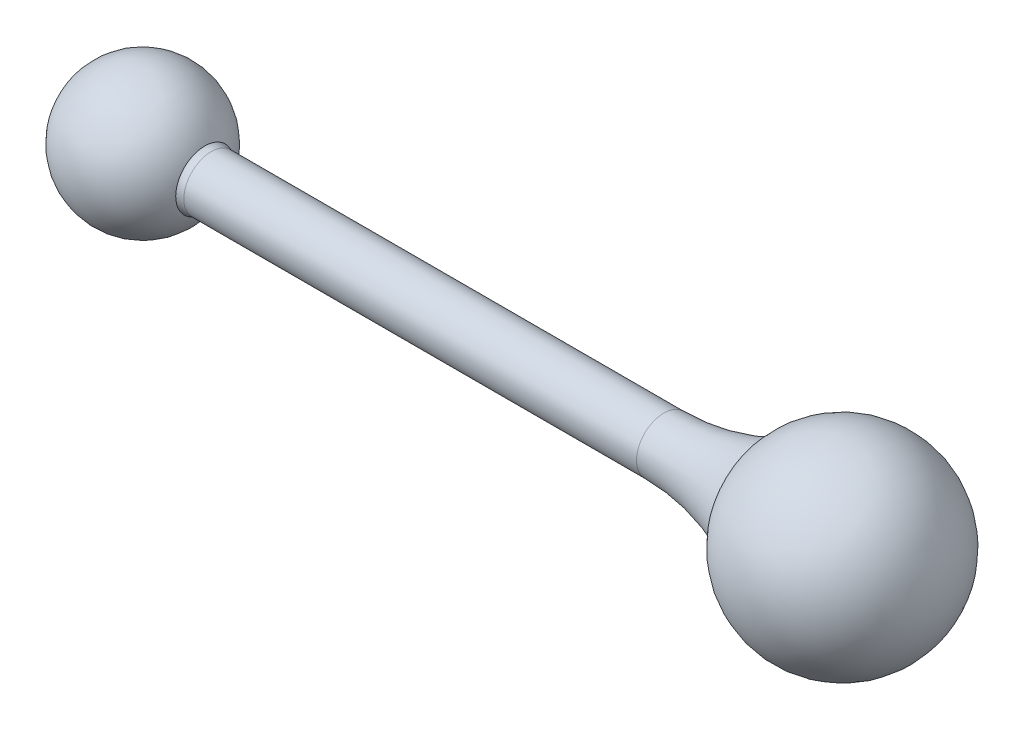
from build123d import *


with BuildPart() as part:
    # Sketch1 → Revolve1 (revolve)
    with BuildSketch(Plane.XY):
        with BuildLine():
            Line((0, 0), (-14, 0))
            ThreePointArc((-14, 0), (-7, -7), (0, 0))
        make_face()
    revolve(axis=Axis((0, 0, 0), (-1, 0, 0)))

    # Sketch2 → Revolve2 (revolve)
    with BuildSketch(Plane.XY, mode=Mode.PRIVATE) as revolve2_sk:
        with BuildLine():
            ThreePointArc((-14, 0), (-13.765454167, -1.796838865), (-13.077534312, -3.473265997))
            ThreePointArc((-13.077534312, -3.473265997), (-16.46124867, -2.372395271), (-20, -2))
            Line((-20, -2), (-53, -2))
            ThreePointArc((-53, -2), (-53.242535625, -2.0298575), (-53.470588235, -2.117647059))
            ThreePointArc((-53.470588235, -2.117647059), (-59.084652289, -4.880935301), (-63, 0))
            Line((-63, 0), (-14, 0))
        make_face()
    revolve(revolve2_sk.sketch.rotate(Axis((0, 0, 0), (-1, 0, 0)), 180), axis=Axis((0, 0, 0), (-1, 0, 0)))


solid = part.part
